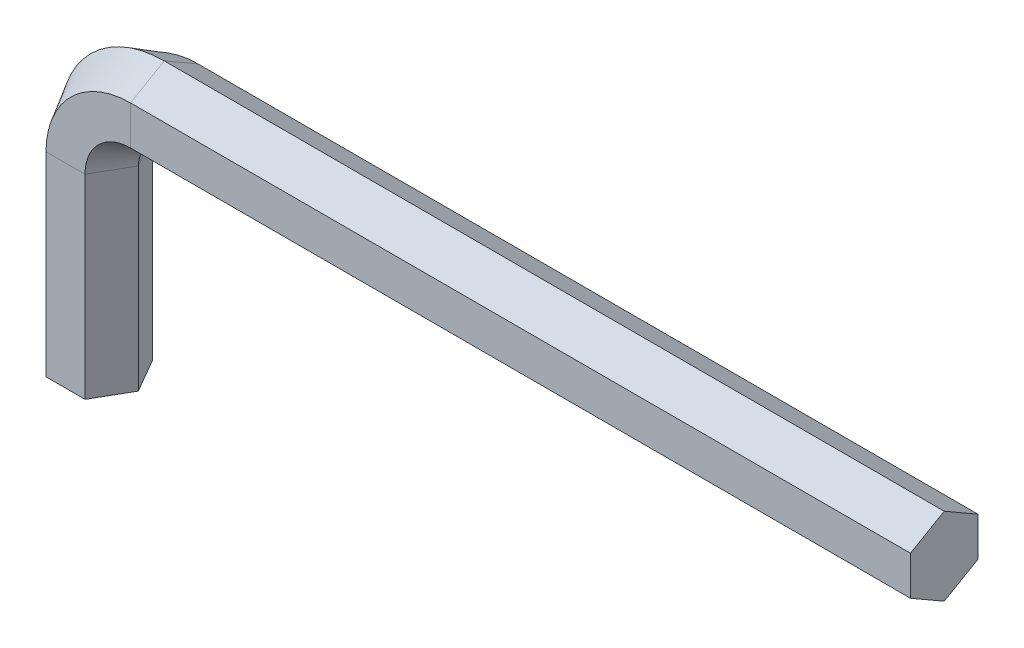
from build123d import *


with BuildPart() as part:
    # Sweep1: sweep along a path in Sketch1
    with BuildLine(Plane.XY) as sweep1_path:
        Line((0, 0), (0, 15))
        ThreePointArc((0, 15), (1.464466094, 18.535533906), (5, 20))
        Line((5, 20), (65, 20))
    # Sketch2 → Sweep1 (sweep)
    with BuildSketch(Plane(origin=(0, 0, 0), x_dir=(1, 0, 0), z_dir=(0, 1, 0))):
        Polygon((3, 0), (1.5, 2.598076211), (-1.5, 2.598076211), (-3, 0), (-1.5, -2.598076211), (1.5, -2.598076211), align=None)
    sweep(path=sweep1_path.line)


solid = part.part
